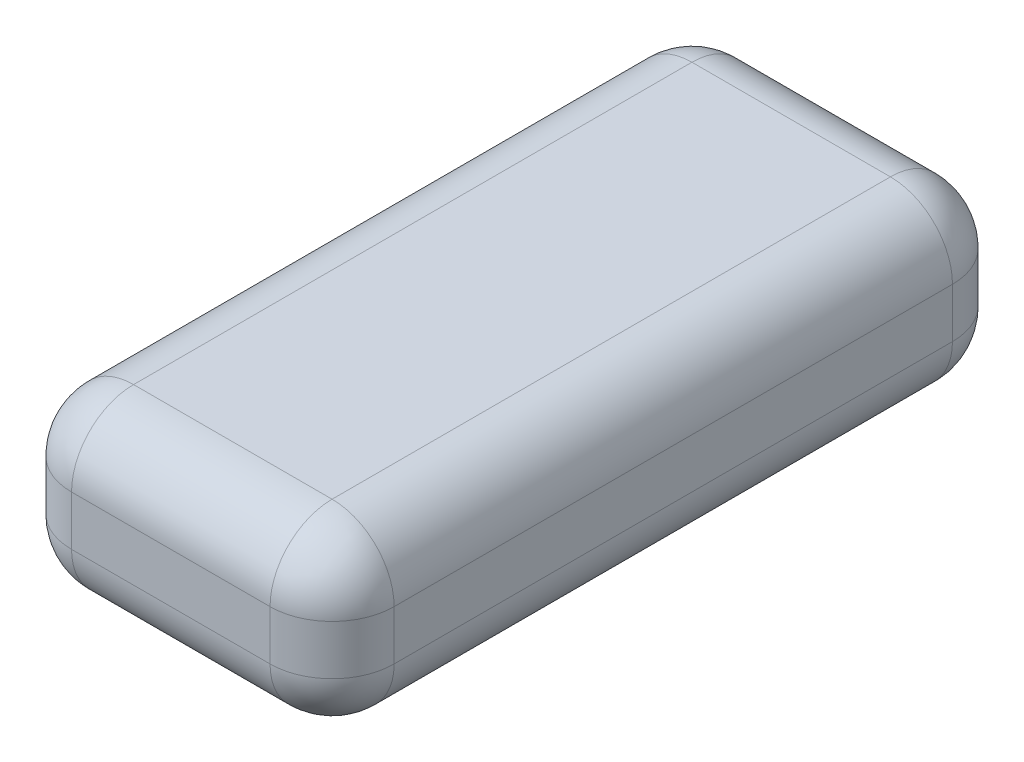
from build123d import *

# Parameters (mm, degrees)
SKETCH_1_W      = 52
SKETCH_1_H      = 28
EXTRUDE_1_DEPTH = 110
FILLET_1_R      = 10


with BuildPart() as part:
    # ｽｹｯﾁ1 → ﾎﾞｽ - 押し出し1 (new body)
    with BuildSketch(Plane.XY):
        Rectangle(SKETCH_1_W, SKETCH_1_H)
    extrude(amount=EXTRUDE_1_DEPTH)

    # ﾌｨﾚｯﾄ1
    fillet_1_edges = [part.edges().sort_by_distance(p)[0] for p in [
        (26, 0, 110),
        (0, 14, 110),
        (-26, 0, 110),
        (0, 14, 0),
        (26, 0, 0),
        (0, -14, 0),
        (-26, 0, 0),
        (-26, 14, 55),
        (26, 14, 55),
        (26, -14, 55),
        (-26, -14, 55),
        (0, -14, 110),
    ]]
    fillet(fillet_1_edges, radius=FILLET_1_R)


solid = part.part
